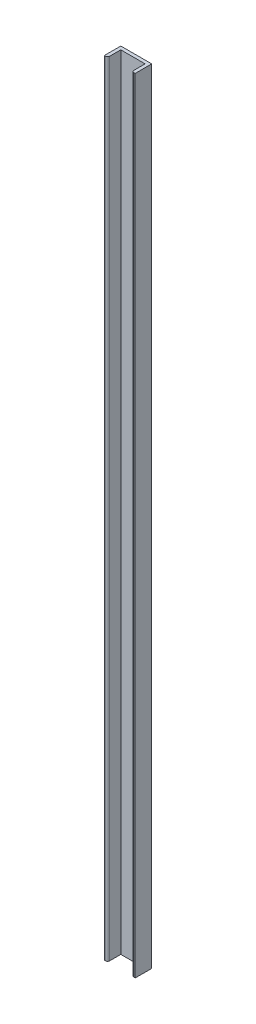
from build123d import *

# Parameters (mm, degrees)
C_CHANNEL_80_X_8_1_DEPTH = 1900


with BuildPart() as part:
    # Sketch11 → C channel 80 X 8(1) (new body)
    with BuildSketch(Plane.ZX):
        with BuildLine():
            Line((0, -37.5), (0, 37.5))
            Line((0, 37.5), (40, 37.5))
            Line((40, 37.5), (40, 34.5))
            ThreePointArc((40, 34.5), (38.535533906, 30.964466094), (35, 29.5))
            Line((35, 29.5), (8, 29.5))
            Line((8, 29.5), (8, -29.5))
            Line((8, -29.5), (35, -29.5))
            ThreePointArc((35, -29.5), (38.535533906, -30.964466094), (40, -34.5))
            Line((40, -34.5), (40, -37.5))
            Line((40, -37.5), (0, -37.5))
        make_face()
    extrude(amount=C_CHANNEL_80_X_8_1_DEPTH)


solid = part.part
